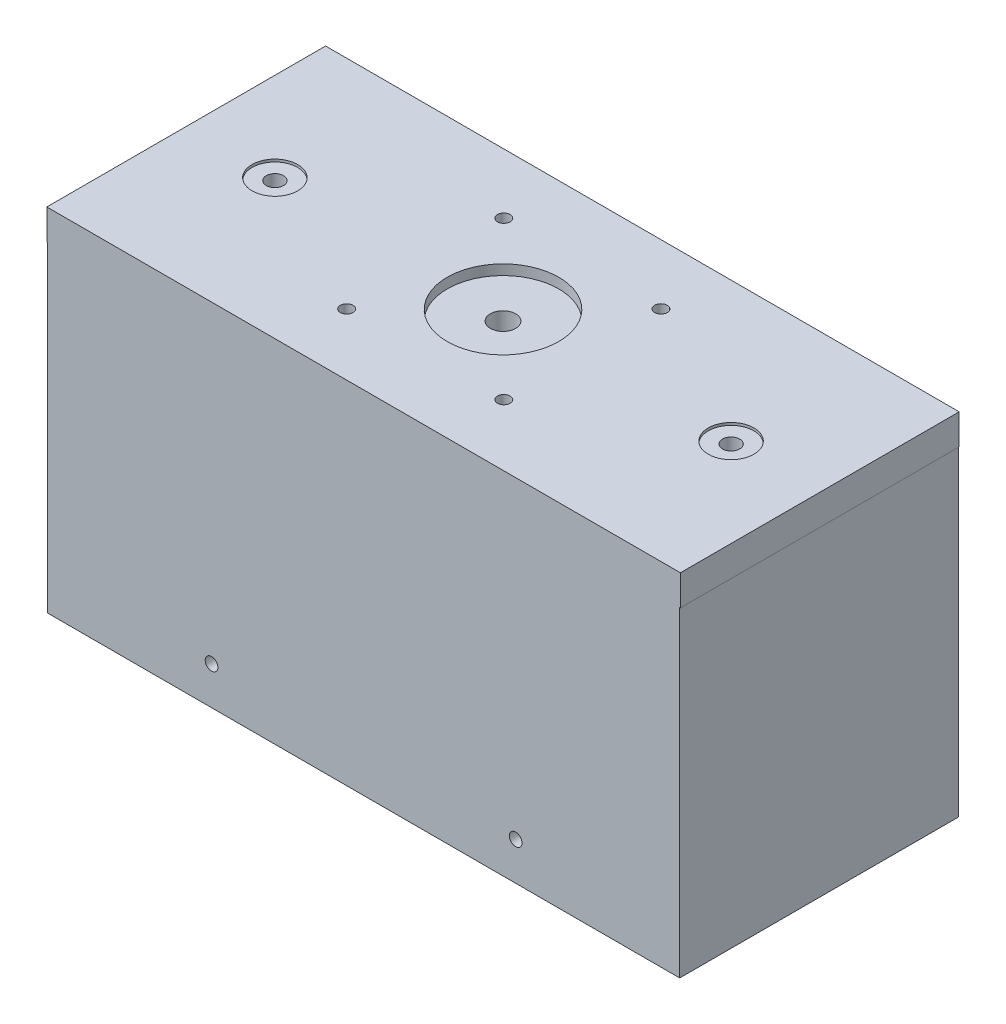
from build123d import *

# Parameters (mm, degrees)
SKETCH_1_W                     = 125
SKETCH_1_H                     = 55
EXTRUDE_1_DEPTH                = 6
SKETCH_2_R                     = 11
CUT_EXTRUDE_1_DEPTH            = 2
CUT_EXTRUDE_2_REACH            = 70.4
SKETCH_3_R                     = 2.5
HOLE_WIZARD_M3_1_D             = 2.5
HOLE_WIZARD_M3_1_DEPTH         = 7.5
HOLE_WIZARD_M3_1_TIP           = 0.751075774
SKETCH_6_W                     = 124.723991502
SKETCH_6_H                     = 55
SKETCH_6_W_2                   = 120
SKETCH_6_H_2                   = 49.685135096
EXTRUDE_2_DEPTH                = 63.306419
HOLE_WIZARD_M3_2_D             = 2.5
HOLE_WIZARD_M3_2_DEPTH         = 2.657432452
HOLE_WIZARD_M3_3_D             = 2.5
HOLE_WIZARD_M3_1_2_D           = 3.4
HOLE_WIZARD_M3_1_2_DEPTH       = 5
HOLE_WIZARD_M3_1_2_CBORE_D     = 9
HOLE_WIZARD_M3_1_2_CBORE_DEPTH = 0.5
HOLE_WIZARD_M3_1_2_TIP         = 1.021463052


with BuildPart() as part:
    # 草图1 → 凸台-拉伸1 (new body)
    with BuildSketch(Plane(origin=(0, 0, 0), x_dir=(1, 0, 0), z_dir=(0, 1, 0))):
        Rectangle(SKETCH_1_W, SKETCH_1_H)
    extrude(amount=EXTRUDE_1_DEPTH)

    # 草图2 → 切除-拉伸1 (cut)
    with BuildSketch(Plane(origin=(0, 6, 0), x_dir=(1, 0, 0), z_dir=(0, 1, 0))):
        with Locations(Location((0, 0, 0), (0, 0, 270))):
            Circle(SKETCH_2_R)
    extrude(amount=-CUT_EXTRUDE_1_DEPTH, mode=Mode.SUBTRACT)

    # 草图3 → 切除-拉伸2 (cut, up to next)
    with BuildSketch(Plane(origin=(0, 4, 0), x_dir=(1, 0, 0), z_dir=(0, 1, 0)), mode=Mode.PRIVATE) as cut_extrude_2_sk1:
        with Locations(Location((0, 0, 0), (0, 0, 270))):
            Circle(SKETCH_3_R)
    cut_extrude_2_tool1 = extrude(cut_extrude_2_sk1.sketch, amount=-CUT_EXTRUDE_2_REACH, mode=Mode.PRIVATE) & part.part
    add(cut_extrude_2_tool1.solids().sort_by_distance((0, 4, 0))[0], mode=Mode.SUBTRACT)

    # Hole Wizard M3 _1
    with Locations(Plane(origin=(0, 6, 0), x_dir=(1, 0, 0), z_dir=(0, 1, 0))):
        with Locations((15.5, 15.657432452), (15.5, -15.342567548), (-15.5, -15.342567548), (-15.5, 15.657432452)):
            Hole(HOLE_WIZARD_M3_1_D / 2, depth=HOLE_WIZARD_M3_1_DEPTH)
            with Locations((0, 0, -(HOLE_WIZARD_M3_1_DEPTH + HOLE_WIZARD_M3_1_TIP / 2))):  # 118° drill point
                Cone(0, HOLE_WIZARD_M3_1_D / 2, HOLE_WIZARD_M3_1_TIP, mode=Mode.SUBTRACT)

    # 草图6 → 凸台-拉伸2 (add)
    with BuildSketch(Plane.XZ):
        Rectangle(SKETCH_6_W, SKETCH_6_H)
        Rectangle(SKETCH_6_W_2, SKETCH_6_H_2, mode=Mode.SUBTRACT)
    extrude(amount=EXTRUDE_2_DEPTH)

    # M3 螺纹孔2
    with Locations(Plane(origin=(0, 0, -27.5), x_dir=(-1, 0, 0), z_dir=(0, 0, -1))):
        with Locations((30, -55.806419172), (-30, -55.806419172)):
            Hole(HOLE_WIZARD_M3_2_D / 2, depth=HOLE_WIZARD_M3_2_DEPTH)

    # M3 螺纹孔3 (through all)
    with Locations(Plane.XY.offset(27.5)):
        with Locations((30, -55.806419172), (-30, -55.806419172)):
            Hole(HOLE_WIZARD_M3_3_D / 2)

    # Hole Wizard M3 _1 2
    with Locations(Plane(origin=(-45, 6, 0), x_dir=(0, 0, 1), z_dir=(0, 1, 0))):
        with Locations((0, 0), (0, 90)):
            CounterBoreHole(HOLE_WIZARD_M3_1_2_D / 2, HOLE_WIZARD_M3_1_2_CBORE_D / 2, HOLE_WIZARD_M3_1_2_CBORE_DEPTH, depth=HOLE_WIZARD_M3_1_2_DEPTH)
            with Locations((0, 0, -(HOLE_WIZARD_M3_1_2_DEPTH + HOLE_WIZARD_M3_1_2_TIP / 2))):  # 118° drill point
                Cone(0, HOLE_WIZARD_M3_1_2_D / 2, HOLE_WIZARD_M3_1_2_TIP, mode=Mode.SUBTRACT)


solid = part.part
